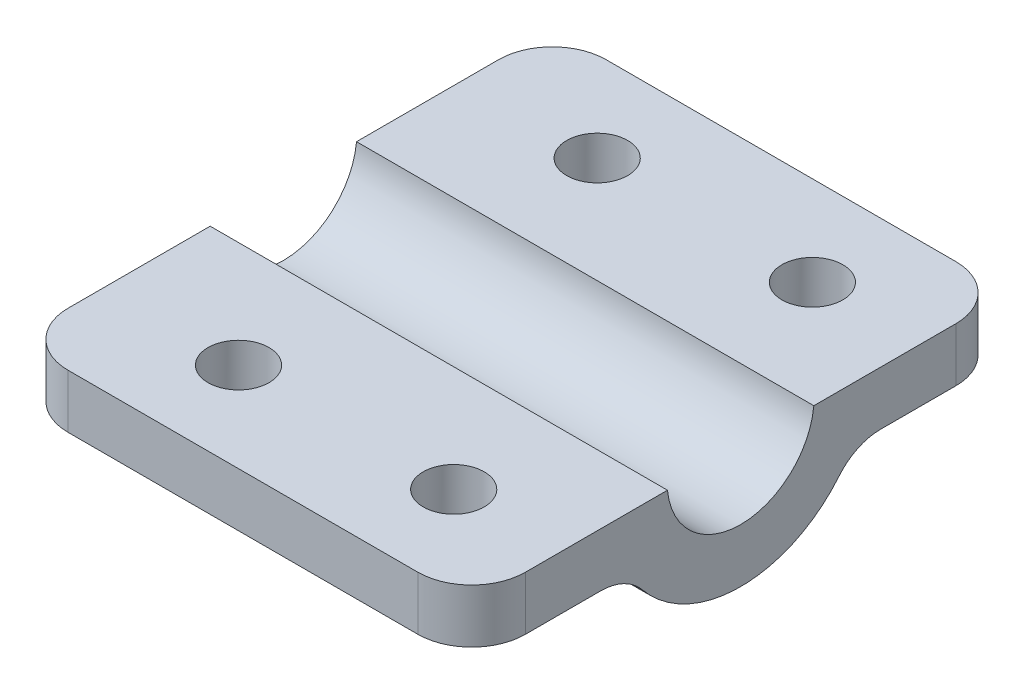
from build123d import *

# Parameters (mm, degrees)
BOSS_EXTRUDE1_DEPTH = 25.5
SKETCH2_R           = 1.7
CUT_EXTRUDE1_DEPTH  = 31.42466105
FILLET1_R           = 3
SKETCH4_R           = 2.85
CUT_EXTRUDE2_DEPTH  = 30.815096847


with BuildPart() as part:
    # Sketch1 → Boss-Extrude1 (new body)
    with BuildSketch(Plane(origin=(0, 0, 0), x_dir=(0, 0, -1), z_dir=(1, 0, 0))):
        with BuildLine():
            Line((4.080441153, -0.4), (15, -0.4))
            Line((15, -0.4), (15, -3.4))
            Line((15, -3.4), (6.232976817, -3.4))
            ThreePointArc((6.232976817, -3.4), (0, -7.1), (-6.232976817, -3.4))
            Line((-6.232976817, -3.4), (-15, -3.4))
            Line((-15, -3.4), (-15, -0.4))
            Line((-15, -0.4), (-4.080441153, -0.4))
            ThreePointArc((-4.080441153, -0.4), (0, -4.1), (4.080441153, -0.4))
        make_face()
    extrude(amount=-BOSS_EXTRUDE1_DEPTH)

    # Sketch2 → Cut-Extrude1 (cut, through all)
    with BuildSketch(Plane(origin=(0, 0, 0), x_dir=(1, 0, 0), z_dir=(0, 1, 0))):
        with Locations(Location((-6, -10, 0), (0, 0, 270))):
            Circle(SKETCH2_R)
        with Locations(Location((-18, -10, 0), (0, 0, 270))):
            Circle(SKETCH2_R)
        with Locations(Location((-6, 10, 0), (0, 0, 270))):
            Circle(SKETCH2_R)
        with Locations(Location((-18, 10, 0), (0, 0, 270))):
            Circle(SKETCH2_R)
    extrude(amount=-CUT_EXTRUDE1_DEPTH, mode=Mode.SUBTRACT)

    # Fillet1
    fillet1_edges = [part.edges().sort_by_distance(p)[0] for p in [
        (0, -1.9, -15),
        (-12.75, -3.4, -6.232976817),
        (-25.5, -1.9, -15),
        (-25.5, -1.9, 15),
        (-12.75, -3.4, 6.232976817),
        (0, -1.9, 15),
    ]]
    fillet(fillet1_edges, radius=FILLET1_R)

    # Sketch4 → Cut-Extrude2 (cut, through all)
    with BuildSketch(Plane.XZ.offset(3.4)):
        with Locations((-18, -10)):
            Circle(SKETCH4_R)
        with Locations((-18, 10)):
            Circle(SKETCH4_R)
        with Locations((-6, 10)):
            Circle(SKETCH4_R)
        with Locations((-6, -10)):
            Circle(SKETCH4_R)
    extrude(amount=CUT_EXTRUDE2_DEPTH, mode=Mode.SUBTRACT)


solid = part.part
